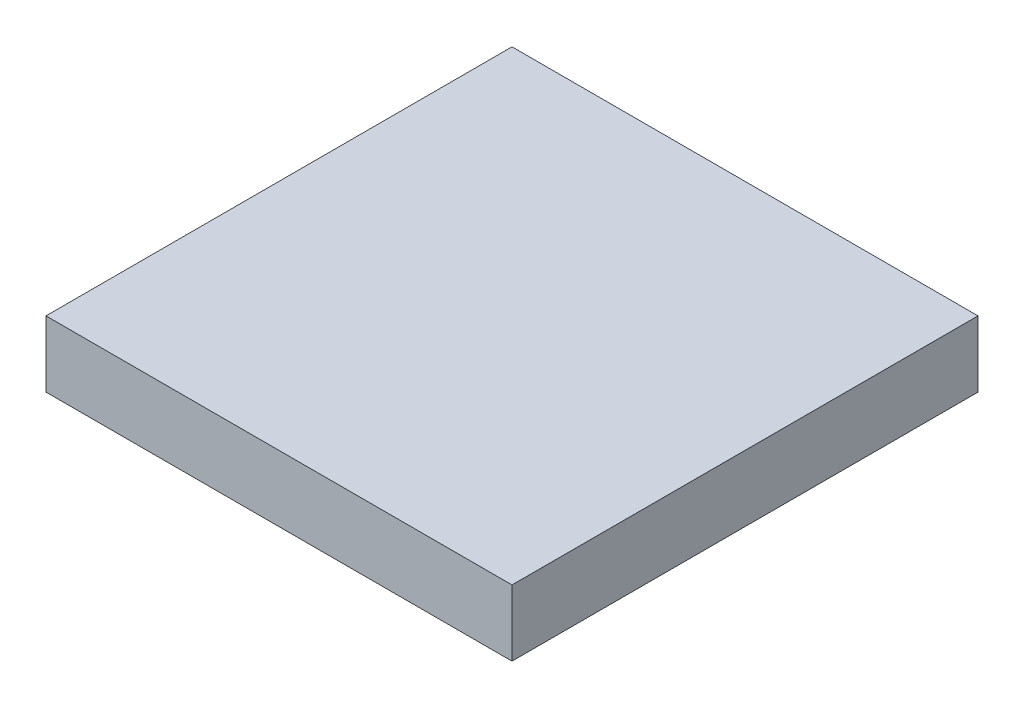
from build123d import *

# Parameters (mm, degrees)
CROQUIS1_W              = 38.1
CROQUIS1_H              = 38.1
SALIENTE_EXTRUIR1_DEPTH = 5.4


with BuildPart() as part:
    # Croquis1 → Saliente-Extruir1 (new body)
    with BuildSketch(Plane(origin=(0, 0, 0), x_dir=(1, 0, 0), z_dir=(0, 1, 0))):
        Rectangle(CROQUIS1_W, CROQUIS1_H)
    extrude(amount=SALIENTE_EXTRUIR1_DEPTH)


solid = part.part
